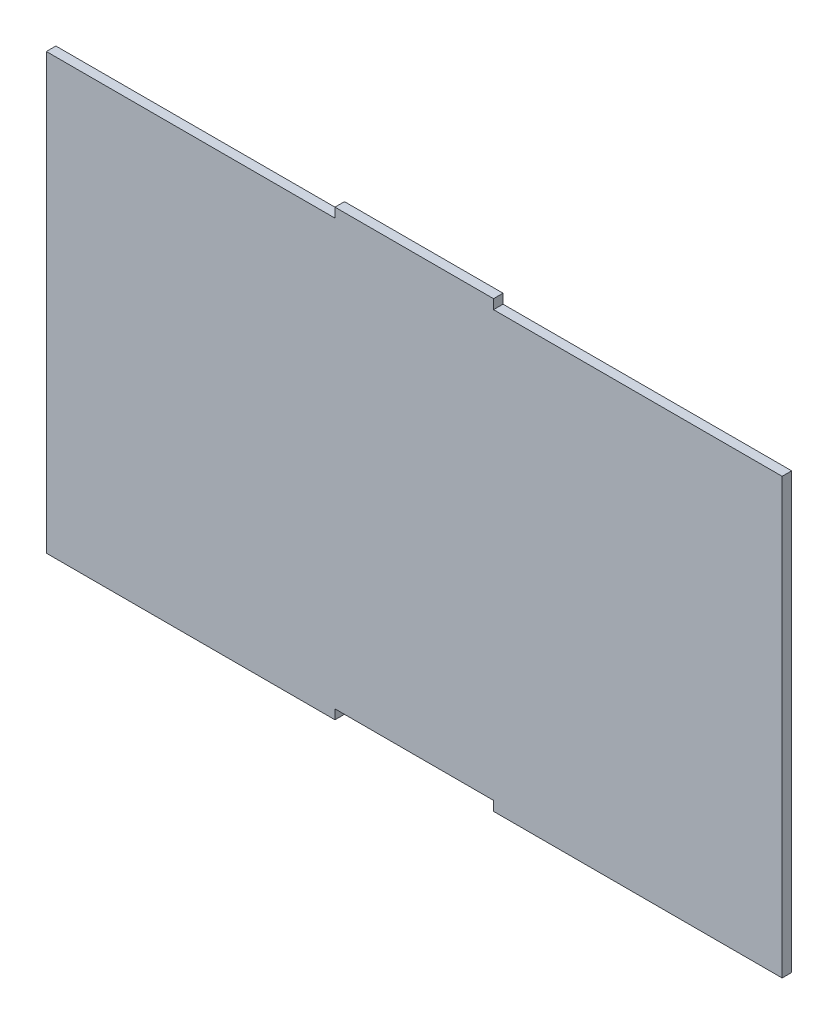
from build123d import *

# Parameters (mm, degrees)
RESSALTO_EXTRUS_O1_DEPTH = 3


with BuildPart() as part:
    # Esboço1 → Ressalto-extrusão1 (new body)
    with BuildSketch(Plane.XY):
        Polygon((0, 0), (0, 137), (91, 137), (91, 140), (141, 140), (141, 137), (232, 137), (232, 0), (141, 0), (141, 3), (91, 3), (91, 0), align=None)
    extrude(amount=RESSALTO_EXTRUS_O1_DEPTH)


solid = part.part
